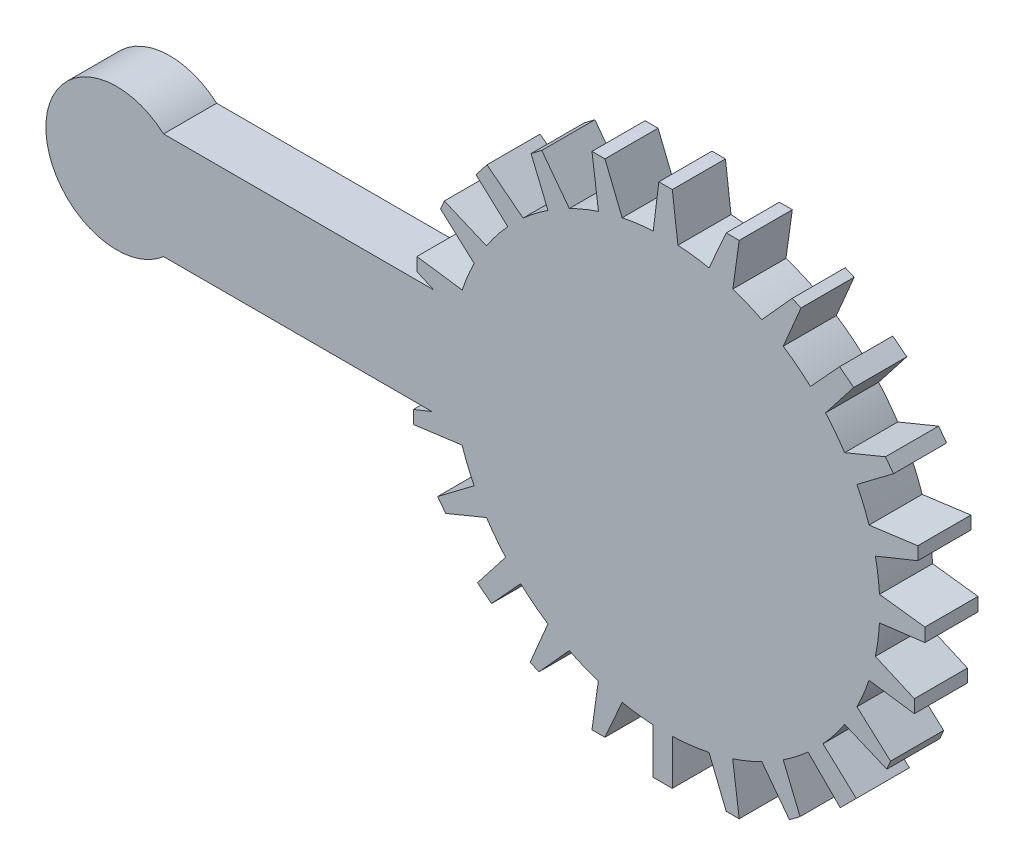
from build123d import *

# Parameters (mm, degrees)
SKETCH1_R            = 12.1
BOSS_EXTRUDE1_DEPTH  = 3
BOSS_EXTRUDE2_DEPTH  = 3
BOSS_EXTRUDE3_DEPTH  = 3
BOSS_EXTRUDE4_DEPTH  = 3
BOSS_EXTRUDE5_DEPTH  = 3
BOSS_EXTRUDE6_DEPTH  = 3
BOSS_EXTRUDE7_DEPTH  = 3
BOSS_EXTRUDE8_DEPTH  = 3
BOSS_EXTRUDE9_DEPTH  = 3
BOSS_EXTRUDE10_DEPTH = 3
BOSS_EXTRUDE11_DEPTH = 3
BOSS_EXTRUDE12_DEPTH = 3
BOSS_EXTRUDE13_DEPTH = 3
BOSS_EXTRUDE14_DEPTH = 3
BOSS_EXTRUDE15_DEPTH = 3
BOSS_EXTRUDE16_DEPTH = 3
BOSS_EXTRUDE17_DEPTH = 3
BOSS_EXTRUDE18_DEPTH = 3
BOSS_EXTRUDE19_DEPTH = 3
BOSS_EXTRUDE20_DEPTH = 3
BOSS_EXTRUDE21_DEPTH = 3
BOSS_EXTRUDE22_DEPTH = 3
BOSS_EXTRUDE23_DEPTH = 3
BOSS_EXTRUDE24_DEPTH = 3
BOSS_EXTRUDE25_DEPTH = 3
SKETCH26_W           = 31
SKETCH26_H           = 6
BOSS_EXTRUDE26_DEPTH = 3
SKETCH27_R           = 4
BOSS_EXTRUDE27_DEPTH = 3


with BuildPart() as part:
    # Sketch1 → Boss-Extrude1 (new body)
    with BuildSketch(Plane.XY):
        Circle(SKETCH1_R)
    extrude(amount=BOSS_EXTRUDE1_DEPTH)

    # Sketch2 → Boss-Extrude2 (add)
    with BuildSketch(Plane.XY):
        Polygon((12.079935981, -0.696524726), (14.645079707, -0.379658233), (14.645079707, 0.379658233), (12.079935981, 0.696524726), align=None)
    extrude(amount=BOSS_EXTRUDE2_DEPTH)

    # Sketch3 → Boss-Extrude3 (add)
    with BuildSketch(Plane.XY):
        Polygon((11.848596009, 2.453726274), (14.244323498, 3.423703853), (14.244323498, 4.157147238), (11.490982299, 3.790425545), align=None)
    extrude(amount=BOSS_EXTRUDE3_DEPTH)

    # Sketch4 → Boss-Extrude4 (add)
    with BuildSketch(Plane.XY):
        Polygon((10.809793799, 5.436759883), (12.872840183, 6.993746179), (12.418878698, 7.595256676), (10.113269073, 6.643176098), align=None)
    extrude(amount=BOSS_EXTRUDE4_DEPTH)

    # Sketch5 → Boss-Extrude5 (add)
    with BuildSketch(Plane.XY):
        Polygon((9.034322006, 8.049287291), (10.624094083, 10.087176261), (9.829208044, 10.707272668), (8.182693208, 8.913671065), align=None)
    extrude(amount=BOSS_EXTRUDE5_DEPTH)

    # Sketch6 → Boss-Extrude6 (add)
    with BuildSketch(Plane.XY):
        Polygon((6.643176098, 10.113269073), (7.651333528, 12.49318195), (7.147254813, 12.706715272), (5.436759883, 10.809793799), align=None)
    extrude(amount=BOSS_EXTRUDE6_DEPTH)

    # Sketch7 → Boss-Extrude7 (add)
    with BuildSketch(Plane.XY):
        Polygon((3.799308717, 11.488048279), (4.157147238, 14.047797936), (3.423703853, 14.047797936), (2.453726274, 11.848596009), align=None)
    extrude(amount=BOSS_EXTRUDE7_DEPTH)

    # Sketch8 → Boss-Extrude8 (add)
    with BuildSketch(Plane.XY):
        Polygon((0.696524726, 12.079935981), (0.379658233, 14.645079707), (-0.379658233, 14.645079707), (-0.696524726, 12.079935981), align=None)
    extrude(amount=BOSS_EXTRUDE8_DEPTH)

    # Sketch9 → Boss-Extrude9 (add)
    with BuildSketch(Plane.XY):
        Polygon((-2.453726274, 11.848596009), (-3.423703853, 14.244323498), (-4.157147238, 14.244323498), (-3.790425545, 11.490982299), align=None)
    extrude(amount=BOSS_EXTRUDE9_DEPTH)

    # Sketch10 → Boss-Extrude10 (add)
    with BuildSketch(Plane.XY):
        Polygon((-5.436759883, 10.809793799), (-6.993746179, 12.872840183), (-7.595256676, 12.418878698), (-6.643176098, 10.113269073), align=None)
    extrude(amount=BOSS_EXTRUDE10_DEPTH)

    # Sketch11 → Boss-Extrude11 (add)
    with BuildSketch(Plane.XY):
        Polygon((-8.049287291, 9.034322006), (-10.087176261, 10.624094083), (-10.707272668, 9.829208044), (-8.913671065, 8.182693208), align=None)
    extrude(amount=BOSS_EXTRUDE11_DEPTH)

    # Sketch12 → Boss-Extrude12 (add)
    with BuildSketch(Plane.XY):
        Polygon((-10.113269073, 6.643176098), (-12.49318195, 7.651333528), (-12.706715272, 7.147254813), (-10.809793799, 5.436759883), align=None)
    extrude(amount=BOSS_EXTRUDE12_DEPTH)

    # Sketch13 → Boss-Extrude13 (add)
    with BuildSketch(Plane.XY):
        Polygon((-11.488048279, 3.799308717), (-14.047797936, 4.157147238), (-14.047797936, 3.423703853), (-11.848596009, 2.453726274), align=None)
    extrude(amount=BOSS_EXTRUDE13_DEPTH)

    # Sketch14 → Boss-Extrude14 (add)
    with BuildSketch(Plane.XY):
        Polygon((-12.079935981, 0.696524726), (-14.645079707, 0.379658233), (-14.645079707, -0.379658233), (-12.079935981, -0.696524726), align=None)
    extrude(amount=BOSS_EXTRUDE14_DEPTH)

    # Sketch15 → Boss-Extrude15 (add)
    with BuildSketch(Plane.XY):
        Polygon((-11.848596009, -2.453726274), (-14.244323498, -3.423703853), (-14.244323498, -4.157147238), (-11.490982299, -3.790425545), align=None)
    extrude(amount=BOSS_EXTRUDE15_DEPTH)

    # Sketch16 → Boss-Extrude16 (add)
    with BuildSketch(Plane.XY):
        Polygon((-10.809793799, -5.436759883), (-12.872840183, -6.993746179), (-12.418878698, -7.595256676), (-10.113269073, -6.643176098), align=None)
    extrude(amount=BOSS_EXTRUDE16_DEPTH)

    # Sketch17 → Boss-Extrude17 (add)
    with BuildSketch(Plane.XY):
        Polygon((-9.034322006, -8.049287291), (-10.624094083, -10.087176261), (-9.829208044, -10.707272668), (-8.182693208, -8.913671065), align=None)
    extrude(amount=BOSS_EXTRUDE17_DEPTH)

    # Sketch18 → Boss-Extrude18 (add)
    with BuildSketch(Plane.XY):
        Polygon((-6.643176098, -10.113269073), (-7.651333528, -12.49318195), (-7.147254813, -12.706715272), (-5.436759883, -10.809793799), align=None)
    extrude(amount=BOSS_EXTRUDE18_DEPTH)

    # Sketch19 → Boss-Extrude19 (add)
    with BuildSketch(Plane.XY):
        Polygon((-3.799308717, -11.488048279), (-4.157147238, -14.047797936), (-3.423703853, -14.047797936), (-2.453726274, -11.848596009), align=None)
    extrude(amount=BOSS_EXTRUDE19_DEPTH)

    # Sketch20 → Boss-Extrude20 (add)
    with BuildSketch(Plane.XY):
        Polygon((-0.696524726, -12.079935981), (-0.696524726, -14.645079707), (0.379658233, -14.645079707), (0.379658233, -12.09404232), align=None)
    extrude(amount=BOSS_EXTRUDE20_DEPTH)

    # Sketch21 → Boss-Extrude21 (add)
    with BuildSketch(Plane.XY):
        Polygon((2.453726274, -11.848596009), (3.423703853, -14.244323498), (4.157147238, -14.244323498), (3.790425545, -11.490982299), align=None)
    extrude(amount=BOSS_EXTRUDE21_DEPTH)

    # Sketch22 → Boss-Extrude22 (add)
    with BuildSketch(Plane.XY):
        Polygon((5.436759883, -10.809793799), (6.993746179, -12.872840183), (7.595256676, -12.418878698), (6.643176098, -10.113269073), align=None)
    extrude(amount=BOSS_EXTRUDE22_DEPTH)

    # Sketch23 → Boss-Extrude23 (add)
    with BuildSketch(Plane.XY):
        Polygon((8.049287291, -9.034322006), (9.863117815, -10.848152529), (10.770033076, -9.941237267), (8.89125817, -8.207041376), align=None)
    extrude(amount=BOSS_EXTRUDE23_DEPTH)

    # Sketch24 → Boss-Extrude24 (add)
    with BuildSketch(Plane.XY):
        Polygon((10.113269073, -6.643176098), (12.49318195, -7.651333528), (12.706715272, -7.147254813), (10.809793799, -5.436759883), align=None)
    extrude(amount=BOSS_EXTRUDE24_DEPTH)

    # Sketch25 → Boss-Extrude25 (add)
    with BuildSketch(Plane.XY):
        Polygon((11.488048279, -3.799308717), (14.047797936, -4.157147238), (14.047797936, -3.423703853), (11.848596009, -2.453726274), align=None)
    extrude(amount=BOSS_EXTRUDE25_DEPTH)

    # Sketch26 → Boss-Extrude26 (add)
    with BuildSketch(Plane.XY):
        with Locations((-15.5, 0)):
            Rectangle(SKETCH26_W, SKETCH26_H)
    extrude(amount=BOSS_EXTRUDE26_DEPTH)

    # Sketch27 → Boss-Extrude27 (add)
    with BuildSketch(Plane.XY):
        with Locations((-31, 0)):
            Circle(SKETCH27_R)
    extrude(amount=BOSS_EXTRUDE27_DEPTH)


solid = part.part
